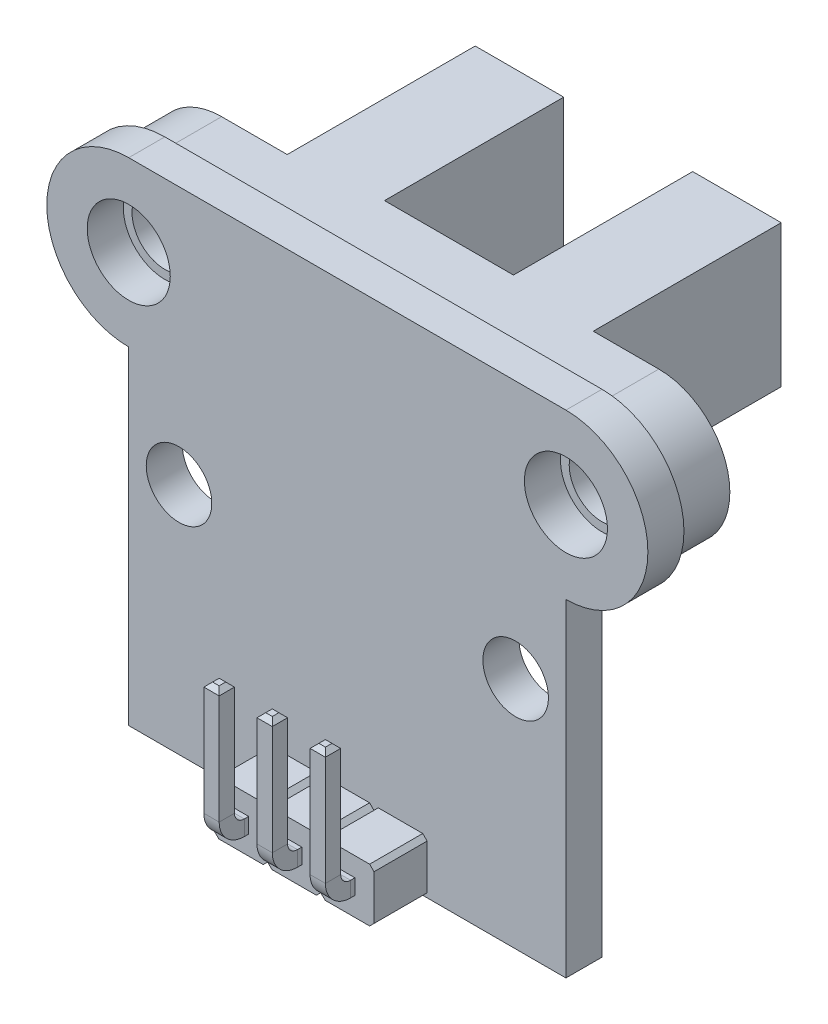
from build123d import *

# Parameters (mm, degrees)
SKETCH2_R           = 1.9
SKETCH2_R_2         = 1.5
BOSS_EXTRUDE1_DEPTH = 1.65
SKETCH3_W           = 0.7
SKETCH3_H           = 0.7
BOSS_EXTRUDE2_DEPTH = 2.43
SKETCH4_W           = 0.7
SKETCH4_H           = 0.7
CUT_EXTRUDE1_DEPTH  = 2.43
SKETCH5_W           = 0.7
SKETCH5_H           = 0.7
CHAMFER1_SIZE       = 0.2
LPATTERN1_COUNT     = 3
LPATTERN1_PITCH     = 2.43
SKETCH7_R           = 1.5
BOSS_EXTRUDE3_DEPTH = 2.6
SKETCH8_W           = 14
SKETCH8_H           = 6.5
BOSS_EXTRUDE4_DEPTH = 8.6
SKETCH9_W           = 5.9
SKETCH9_H           = 6.5
CUT_EXTRUDE2_DEPTH  = 8.2
BOSS_EXTRUDE5_DEPTH = 0.1
BOSS_EXTRUDE6_DEPTH = 0.1


with BuildPart() as part:
    # Sketch2 → Boss-Extrude1 (new body)
    with BuildSketch(Plane.XY):
        with BuildLine():
            Line((-10, -18.75), (-10, -3.75))
            ThreePointArc((-10, -3.75), (-13.75, 0), (-10, 3.75))
            Line((-10, 3.75), (10, 3.75))
            ThreePointArc((10, 3.75), (13.75, 0), (10, -3.75))
            Line((10, -3.75), (10, -18.75))
            Line((10, -18.75), (-10, -18.75))
        make_face()
        with Locations((10, 0)):
            Circle(SKETCH2_R, mode=Mode.SUBTRACT)
        with Locations((-10, 0)):
            Circle(SKETCH2_R, mode=Mode.SUBTRACT)
        with Locations((7.7, -8.05)):
            Circle(SKETCH2_R_2, mode=Mode.SUBTRACT)
        with Locations(Location((-7.7, -8.05, 0), (0, 0, 180))):
            Circle(SKETCH2_R_2, mode=Mode.SUBTRACT)
    extrude(amount=BOSS_EXTRUDE1_DEPTH)

    # Sketch4 → Cut-Extrude1 (cut)
    with BuildSketch(Plane.XY.offset(1.65)):
        with Locations((2.426666667, -17.525)):
            Rectangle(SKETCH4_W, SKETCH4_H)
        with Locations((-0.003333333, -17.525)):
            Rectangle(SKETCH4_W, SKETCH4_H)
        with Locations((-2.433333333, -17.525)):
            Rectangle(SKETCH4_W, SKETCH4_H)
    extrude(amount=-CUT_EXTRUDE1_DEPTH, mode=Mode.SUBTRACT)


with BuildPart() as body_2:
    # Sketch3 → Boss-Extrude2 (new body)
    with BuildSketch(Plane.XY.offset(1.65)):
        Polygon((3.45, -18.75), (1.416666667, -18.75), (1.216666667, -18.55), (1.016666667, -18.75), (-1.016666667, -18.75), (-1.216666667, -18.55), (-1.416666667, -18.75), (-3.45, -18.75), (-3.65, -18.55), (-3.65, -16.5), (-3.45, -16.3), (-1.416666667, -16.3), (-1.216666667, -16.5), (-1.016666667, -16.3), (1.016666667, -16.3), (1.216666667, -16.5), (1.416666667, -16.3), (3.45, -16.3), (3.65, -16.5), (3.65, -18.55), align=None)
        with Locations((-0.003333333, -17.525)):
            Rectangle(SKETCH3_W, SKETCH3_H, mode=Mode.SUBTRACT)
        with Locations((-2.433333333, -17.525)):
            Rectangle(SKETCH3_W, SKETCH3_H, mode=Mode.SUBTRACT)
        with Locations((2.426666667, -17.525)):
            Rectangle(SKETCH3_W, SKETCH3_H, mode=Mode.SUBTRACT)
    extrude(amount=BOSS_EXTRUDE2_DEPTH)


with BuildPart() as body_3:
    # Sweep1: sweep along a path in Sketch6
    with BuildLine(Plane.ZY.offset(2.433333333)) as sweep1_path:
        Line((-1, -17.525), (4.28, -17.525))
        ThreePointArc((4.28, -17.525), (4.845685425, -17.290685425), (5.08, -16.725))
        Line((5.08, -16.725), (5.08, -11.525))
    # Sketch5 → Sweep1 (sweep)
    with BuildSketch(Plane.XY.offset(-1)):
        with Locations((-2.433333333, -17.525)):
            Rectangle(SKETCH5_W, SKETCH5_H)
    sweep(path=sweep1_path.line)

    # Chamfer1
    chamfer1_edges = [body_3.edges().sort_by_distance(p)[0] for p in [
        (-2.433333333, -17.175, -1),
        (-2.783333333, -17.525, -1),
        (-2.433333333, -17.875, -1),
        (-2.083333333, -11.525, 5.08),
        (-2.433333333, -11.525, 4.73),
        (-2.783333333, -11.525, 5.08),
        (-2.433333333, -11.525, 5.43),
        (-2.083333333, -17.525, -1),
    ]]
    chamfer(chamfer1_edges, length=CHAMFER1_SIZE)


with BuildPart() as lpattern1_1:
    # LPattern1: pattern copy
    add(body_3.part.moved(Location(Vector(1, 0, 0) * (1 * LPATTERN1_PITCH))))


with BuildPart() as lpattern1_2:
    # LPattern1: pattern copy
    add(body_3.part.moved(Location(Vector(1, 0, 0) * (2 * LPATTERN1_PITCH))))


with BuildPart() as body_6:
    # Sketch7 → Boss-Extrude3 (new body)
    with BuildSketch(Plane(origin=(0, 0, 0), x_dir=(-1, 0, 0), z_dir=(0, 0, -1))):
        with BuildLine():
            Line((10, -3.25), (-10, -3.25))
            ThreePointArc((-10, -3.25), (-13.25, 0), (-10, 3.25))
            Line((-10, 3.25), (10, 3.25))
            ThreePointArc((10, 3.25), (13.25, 0), (10, -3.25))
        make_face()
        with Locations((-10, 0)):
            Circle(SKETCH7_R, mode=Mode.SUBTRACT)
        with Locations((10, 0)):
            Circle(SKETCH7_R, mode=Mode.SUBTRACT)
    extrude(amount=BOSS_EXTRUDE3_DEPTH)

    # Sketch8 → Boss-Extrude4 (add)
    with BuildSketch(Plane(origin=(0, 0, -2.6), x_dir=(-1, 0, 0), z_dir=(0, 0, -1))):
        Rectangle(SKETCH8_W, SKETCH8_H)
    extrude(amount=BOSS_EXTRUDE4_DEPTH)

    # Sketch9 → Cut-Extrude2 (cut)
    with BuildSketch(Plane(origin=(0, 0, -11.2), x_dir=(-1, 0, 0), z_dir=(0, 0, -1))):
        Rectangle(SKETCH9_W, SKETCH9_H)
    extrude(amount=-CUT_EXTRUDE2_DEPTH, mode=Mode.SUBTRACT)

    # Sketch10 → Boss-Extrude5 (add)
    with BuildSketch(Plane(origin=(0, 0, -11.2), x_dir=(-1, 0, 0), z_dir=(0, 0, -1))):
        Polygon((-5.103201591, -1.8452463), (-5.103201591, -0.943409624), (-6.385633173, -0.943409624), (-6.385633173, -0.776593002), (-5.103201591, -0.776593002), (-6.273012274, 1.136059696), (-5.205413608, 1.136059696), (-5.205413608, 2.203658363), (-4.744586392, 2.203658363), (-4.744586392, 1.136059696), (-3.676987726, 1.136059696), (-4.846798409, -0.776593002), (-3.564366827, -0.776593002), (-3.564366827, -0.943409624), (-4.846798409, -0.943409624), (-4.846798409, -1.8452463), align=None)
    extrude(amount=BOSS_EXTRUDE5_DEPTH)

    # Sketch11 → Boss-Extrude6 (add)
    # profile 1 of 7: a face of its own
    with BuildSketch(Plane(origin=(0, 0, -11.2), x_dir=(-1, 0, 0), z_dir=(0, 0, -1))):
        with BuildLine():
            add(Edge.make_bspline(
                [(4.127217434, 0.928389574), (4.1324997, 0.912752669), (4.143037474, 0.881558072), (4.153534993, 0.833060012), (4.160182952, 0.783575079), (4.160987111, 0.750125621), (4.161391283, 0.733313851)],
                knots=[0, 0, 0, 0, 0.994474773, 1.983911717, 2.986709619, 4, 4, 4, 4], degree=3))
            add(Edge.make_bspline(
                [(4.161391283, 0.733313851), (4.161081631, 0.720011242), (4.160478328, 0.694093456), (4.155861214, 0.656410681), (4.147994564, 0.621141768), (4.137252151, 0.588089621), (4.12287733, 0.557612219), (4.105718105, 0.52932936), (4.08530462, 0.503528993), (4.061616232, 0.480313029), (4.035024878, 0.459581001), (4.00530861, 0.441668313), (3.972649143, 0.426556034), (3.936924077, 0.41439115), (3.898402035, 0.404473331), (3.856793425, 0.39797921), (3.812264043, 0.39377157), (3.781573591, 0.393262301), (3.765722184, 0.392999268)],
                knots=[0, 0, 0, 0, 1.072461845, 2.089502642, 3.055154834, 3.982506854, 4.885653992, 5.766011576, 6.644638719, 7.530942326, 8.434292162, 9.357290509, 10.322575283, 11.330177533, 12.396475876, 13.525855063, 14.722121131, 16, 16, 16, 16], degree=3))
            add(Edge.make_bspline(
                [(3.765722184, 0.392999268), (3.750286888, 0.39332699), (3.720121967, 0.393967451), (3.67594444, 0.398382328), (3.63408115, 0.40609221), (3.594462689, 0.4164079), (3.557608044, 0.430033542), (3.523373904, 0.445988804), (3.492119297, 0.464719543), (3.463784648, 0.485963161), (3.438526681, 0.509833206), (3.41615598, 0.536021889), (3.397036739, 0.564755489), (3.380939477, 0.595621531), (3.368218483, 0.628750818), (3.359287179, 0.663879488), (3.353507416, 0.700907379), (3.352913856, 0.726231334), (3.352610182, 0.739187481)],
                knots=[0, 0, 0, 0, 1.219583202, 2.383409664, 3.503355981, 4.580195591, 5.613927346, 6.60373989, 7.560461434, 8.487729334, 9.396383554, 10.300965463, 11.203297331, 12.117485303, 13.046422561, 14.000383661, 14.976963838, 16, 16, 16, 16], degree=3))
            add(Edge.make_bspline(
                [(3.352610182, 0.739187481), (3.352703445, 0.748030774), (3.352886999, 0.765435546), (3.35460753, 0.791016649), (3.356925708, 0.815639936), (3.362047603, 0.846933444), (3.370616174, 0.884941784), (3.381412956, 0.913955914), (3.386784031, 0.928389574)],
                knots=[0, 0, 0, 0, 0.82263702, 1.61905864, 2.384719601, 3.122514214, 4.568537041, 6, 6, 6, 6], degree=3))
            Line((3.386784031, 0.928389574), (3.489305579, 0.928389574))
            add(Edge.make_bspline(
                [(3.489305579, 0.928389574), (3.485719131, 0.921370611), (3.478611992, 0.907461378), (3.46947177, 0.885870078), (3.461764169, 0.863901071), (3.454948606, 0.841523003), (3.450107047, 0.818390264), (3.446228405, 0.794415571), (3.444155805, 0.769363857), (3.443880351, 0.75230264), (3.443740447, 0.743637201)],
                knots=[0, 0, 0, 0, 0.983555818, 1.94907818, 2.92339169, 3.888715259, 4.866203398, 5.870584672, 6.918464223, 8, 8, 8, 8], degree=3))
            add(Edge.make_bspline(
                [(3.443740447, 0.743637201), (3.443930965, 0.734777746), (3.444303953, 0.717433063), (3.448679405, 0.69210356), (3.455096588, 0.66797449), (3.464492541, 0.645259384), (3.476164994, 0.62394211), (3.49067959, 0.604509431), (3.507025303, 0.586306574), (3.526080241, 0.570119296), (3.547385018, 0.555621271), (3.571039576, 0.543078354), (3.596697281, 0.531949849), (3.624683686, 0.522960435), (3.654705053, 0.515642185), (3.686848962, 0.510561929), (3.720988115, 0.507526274), (3.744416387, 0.507120704), (3.756466766, 0.506912099)],
                knots=[0, 0, 0, 0, 0.961321688, 1.882036724, 2.784158746, 3.668588788, 4.54556749, 5.416939704, 6.297416125, 7.197763834, 8.125489491, 9.091444601, 10.101847706, 11.159586289, 12.280336908, 13.455344771, 14.691151478, 16, 16, 16, 16], degree=3))
            add(Edge.make_bspline(
                [(3.756466766, 0.506912099), (3.769050133, 0.507058837), (3.79342092, 0.507343032), (3.828795793, 0.510211443), (3.861784113, 0.515004518), (3.892465294, 0.521468239), (3.920729269, 0.529959893), (3.946501827, 0.540523195), (3.970023702, 0.552774181), (3.991115419, 0.567037811), (4.009849936, 0.583197213), (4.026098157, 0.601169569), (4.039789731, 0.621067704), (4.051055576, 0.642616149), (4.059566787, 0.666057808), (4.065806478, 0.691099624), (4.06959518, 0.717951024), (4.070034984, 0.736445787), (4.070261018, 0.745951055)],
                knots=[0, 0, 0, 0, 1.344764027, 2.604466577, 3.790065809, 4.905748876, 5.95291627, 6.939762846, 7.878684932, 8.782738285, 9.654914262, 10.51702678, 11.364887745, 12.22998046, 13.108770886, 14.023899159, 14.984395335, 16, 16, 16, 16], degree=3))
            add(Edge.make_bspline(
                [(4.070261018, 0.745951055), (4.070144434, 0.754144838), (4.069913321, 0.770387975), (4.067450801, 0.79445337), (4.063824131, 0.818025676), (4.058354326, 0.841042128), (4.051756501, 0.863593684), (4.044184269, 0.885777215), (4.035013899, 0.907332811), (4.028140777, 0.921359319), (4.024695886, 0.928389574)],
                knots=[0, 0, 0, 0, 1.035533676, 2.052814528, 3.055360482, 4.048773743, 5.04096863, 6.025393086, 7.010303204, 8, 8, 8, 8], degree=3))
            Line((4.024695886, 0.928389574), (4.127217434, 0.928389574))
        make_face()
    # profile 2 of 7: a face of its own
    with BuildSketch(Plane(origin=(0, 0, -11.2), x_dir=(-1, 0, 0), z_dir=(0, 0, -1))):
        Polygon((3.364001465, 0.347434135), (3.867709765, 0.062652057), (4.15, 0.062652057), (4.15, -0.051260774), (3.865217922, -0.051260774), (3.364001465, -0.336042852), (3.364001465, -0.199347455), (3.650563431, -0.04592111), (3.765722184, 0.010679328), (3.661420748, 0.06371999), (3.364001465, 0.222130021), align=None)
    # profile 3 of 7: a face of its own
    with BuildSketch(Plane(origin=(0, 0, -11.2), x_dir=(-1, 0, 0), z_dir=(0, 0, -1))):
        Polygon((3.364001465, -0.358825418), (4.15, -0.415781834), (4.15, -0.563868514), (3.864327978, -0.653040903), (3.772841736, -0.677781346), (3.871803508, -0.705013632), (4.15, -0.791694177), (4.15, -0.928389574), (3.364001465, -0.98534599), (3.364001465, -0.882824442), (3.904197469, -0.849896514), (4.044630631, -0.84010713), (3.925200147, -0.80308546), (3.626000977, -0.710175307), (3.626000977, -0.638267832), (3.946380814, -0.532542486), (4.044630631, -0.497122715), (3.944422937, -0.494630872), (3.364001465, -0.461346966), align=None)
    # profile 4 of 7: a face of its own
    with BuildSketch(Plane(origin=(0, 0, -11.2), x_dir=(-1, 0, 0), z_dir=(0, 0, -1))):
        with BuildLine():
            add(Edge.make_bspline(
                [(6.390581927, 1.287214992), (6.399614794, 1.286988099), (6.41746274, 1.286539783), (6.443721658, 1.282595224), (6.469196352, 1.276699454), (6.493539094, 1.267799468), (6.516867632, 1.257077686), (6.538696024, 1.243995931), (6.558945358, 1.228806313), (6.577402581, 1.211425151), (6.594487957, 1.192405371), (6.609376252, 1.171211364), (6.622717862, 1.148386846), (6.633631865, 1.123561925), (6.642623728, 1.097214664), (6.648927687, 1.069354144), (6.653033972, 1.040110783), (6.653441148, 1.020127555), (6.653649372, 1.009908444)],
                knots=[0, 0, 0, 0, 1.012980012, 2.001536605, 2.973591609, 3.942221059, 4.904239254, 5.85072184, 6.792063077, 7.738826575, 8.691400281, 9.655673227, 10.639961518, 11.653204005, 12.693190617, 13.75902196, 14.853998857, 16, 16, 16, 16], degree=3))
            add(Edge.make_bspline(
                [(6.653649372, 1.009908444), (6.653436201, 0.999276213), (6.653021406, 0.978587618), (6.649056133, 0.94852864), (6.642443472, 0.920402031), (6.633435134, 0.894073054), (6.621653228, 0.869717675), (6.607107908, 0.847314589), (6.589532031, 0.827165719), (6.569177167, 0.809031719), (6.546070694, 0.792927743), (6.520054943, 0.779135385), (6.49137747, 0.767096136), (6.459807317, 0.757459769), (6.425356999, 0.749772459), (6.387988172, 0.744421678), (6.34757489, 0.740930868), (6.319631584, 0.740603232), (6.305147304, 0.740433403)],
                knots=[0, 0, 0, 0, 1.014028666, 1.973135184, 2.886201514, 3.766972031, 4.622683754, 5.461089008, 6.307784963, 7.165703144, 8.056080278, 8.988093605, 9.969998106, 11.019187833, 12.132953401, 13.334569633, 14.618386831, 16, 16, 16, 16], degree=3))
            add(Edge.make_bspline(
                [(6.305147304, 0.740433403), (6.285374673, 0.740784927), (6.246327737, 0.741479115), (6.19812565, 0.746709632), (6.160703288, 0.752748465), (6.133720847, 0.758909393), (6.107410163, 0.765951506), (6.082002553, 0.774449505), (6.057536746, 0.784493051), (6.033995633, 0.795759887), (6.011654622, 0.808935584), (5.990229546, 0.823378361), (5.970243731, 0.839918712), (5.951488166, 0.858021078), (5.934314768, 0.878137587), (5.91862218, 0.900087424), (5.904446525, 0.924034042), (5.892310228, 0.950189772), (5.881357286, 0.978133198), (5.872309604, 1.008255155), (5.864941852, 1.040579587), (5.859901052, 1.075335769), (5.856869029, 1.112494322), (5.856466878, 1.138054358), (5.856259553, 1.15123155)],
                knots=[0, 0, 0, 0, 1.86776132, 3.688449948, 4.57502302, 5.448166719, 6.3021877, 7.147777351, 7.977459899, 8.799818917, 9.611291397, 10.426048969, 11.238566389, 12.059184841, 12.88611679, 13.733933342, 14.605942585, 15.511193848, 16.455406888, 17.439626169, 18.479988232, 19.585148465, 20.755050142, 22, 22, 22, 22], degree=3))
            Line((5.856259553, 1.15123155), (5.856259553, 1.230258577))
            Line((5.856259553, 1.230258577), (5.947389818, 1.230258577))
            Line((5.947389818, 1.230258577), (5.947389818, 1.145179931))
            add(Edge.make_bspline(
                [(5.947389818, 1.145179931), (5.947574882, 1.133720204), (5.947933323, 1.11152453), (5.951243424, 1.079476643), (5.956211254, 1.049650561), (5.963783883, 1.022250038), (5.972958663, 0.997007734), (5.984087239, 0.974006258), (5.996905256, 0.953133991), (6.011356846, 0.934233672), (6.027712217, 0.917620275), (6.045530584, 0.902966529), (6.064987807, 0.890350254), (6.086049266, 0.879915739), (6.108476854, 0.871365692), (6.132250158, 0.86491338), (6.157110361, 0.859522318), (6.174300536, 0.857743267), (6.183046988, 0.856838077)],
                knots=[0, 0, 0, 0, 1.315973336, 2.548831764, 3.697292751, 4.785169583, 5.809382063, 6.778678215, 7.714946875, 8.61872859, 9.505493491, 10.386846915, 11.263974212, 12.163092911, 13.082011328, 14.016293524, 14.990679636, 16, 16, 16, 16], degree=3))
            Line((6.183046988, 0.856838077), (6.197998047, 0.854346234))
            add(Edge.make_bspline(
                [(6.197998047, 0.854346234), (6.19464009, 0.860887386), (6.187818721, 0.874175112), (6.179155025, 0.895403725), (6.171308305, 0.917964655), (6.16461005, 0.941977063), (6.158939668, 0.967187187), (6.155478622, 0.993584774), (6.15270184, 1.020885578), (6.152523584, 1.039446786), (6.152432914, 1.048887991)],
                knots=[0, 0, 0, 0, 0.874066819, 1.775583219, 2.723927479, 3.713478467, 4.739001445, 5.79372153, 6.877770845, 8, 8, 8, 8], degree=3))
            add(Edge.make_bspline(
                [(6.152432914, 1.048887991), (6.152606056, 1.058510758), (6.152941745, 1.077167425), (6.156440493, 1.104206484), (6.161881798, 1.12943211), (6.169515187, 1.152822146), (6.179209987, 1.174311806), (6.190553983, 1.194021458), (6.203877247, 1.211712859), (6.218652298, 1.227750044), (6.235363068, 1.241592038), (6.253456716, 1.253813721), (6.27312596, 1.26420296), (6.294375709, 1.272462193), (6.316887858, 1.279066852), (6.340522903, 1.283831795), (6.365233128, 1.286768119), (6.382030197, 1.287064234), (6.390581927, 1.287214992)],
                knots=[0, 0, 0, 0, 1.208556461, 2.343155189, 3.419431942, 4.447318821, 5.428339253, 6.377103145, 7.298556389, 8.20581645, 9.11071493, 10.018434325, 10.945509996, 11.899356745, 12.878363894, 13.890119218, 14.925816695, 16, 16, 16, 16], degree=3))
        make_face()
        with BuildLine():
            add(Edge.make_bspline(
                [(6.392183826, 1.173302161), (6.386187726, 1.173204825), (6.374469895, 1.173014607), (6.357343199, 1.171379904), (6.341095598, 1.168747518), (6.32580095, 1.165012293), (6.311391966, 1.160321195), (6.298246652, 1.153959404), (6.285953976, 1.146764038), (6.275128085, 1.137932204), (6.265361197, 1.128046951), (6.256860774, 1.1169308), (6.24921183, 1.104738768), (6.243126015, 1.091163489), (6.237919514, 1.076396436), (6.234793257, 1.060143377), (6.232516563, 1.042603942), (6.232289499, 1.030445001), (6.232171896, 1.024147548)],
                knots=[0, 0, 0, 0, 1.150142406, 2.247656637, 3.297444227, 4.305103413, 5.266169057, 6.197938694, 7.101757327, 7.992362899, 8.869704092, 9.762198851, 10.671947039, 11.624345717, 12.610627194, 13.66877388, 14.792593229, 16, 16, 16, 16], degree=3))
            add(Edge.make_bspline(
                [(6.232171896, 1.024147548), (6.232366481, 1.016599736), (6.232760625, 1.001311171), (6.236356621, 0.978458742), (6.241668068, 0.955675974), (6.248813978, 0.933344537), (6.257352579, 0.911746025), (6.26687288, 0.891123718), (6.277461195, 0.871998755), (6.285316108, 0.860114156), (6.289128312, 0.854346234)],
                knots=[0, 0, 0, 0, 0.996890633, 2.019264328, 3.050081844, 4.086608987, 5.114559797, 6.11781294, 7.086523066, 8, 8, 8, 8], degree=3))
            add(Edge.make_bspline(
                [(6.289128312, 0.854346234), (6.301648988, 0.854490542), (6.32563875, 0.854767039), (6.35997951, 0.856630989), (6.391103047, 0.860024358), (6.419194754, 0.864524938), (6.44436572, 0.870544325), (6.46681518, 0.877847043), (6.486687537, 0.886279913), (6.503973677, 0.896182234), (6.519009437, 0.907151585), (6.53132122, 0.919833351), (6.541711931, 0.933413881), (6.549559476, 0.948461346), (6.555420239, 0.964588123), (6.559470212, 0.981861395), (6.562009754, 1.000281244), (6.562346093, 1.012984988), (6.562519107, 1.019519839)],
                knots=[0, 0, 0, 0, 1.650217066, 3.161835375, 4.530521021, 5.774907608, 6.909062833, 7.93773963, 8.883385504, 9.748530785, 10.558635498, 11.327220022, 12.070075277, 12.804653334, 13.55422769, 14.326146309, 15.138963686, 16, 16, 16, 16], degree=3))
            add(Edge.make_bspline(
                [(6.562519107, 1.019519839), (6.562391471, 1.025045181), (6.562142058, 1.035842316), (6.559913241, 1.051692242), (6.55640317, 1.066848276), (6.551389514, 1.081257626), (6.545167998, 1.094902809), (6.537518709, 1.107611411), (6.528306574, 1.119202228), (6.518002417, 1.129960647), (6.506272834, 1.139554795), (6.49355394, 1.148411307), (6.479234308, 1.155572732), (6.464043969, 1.162110291), (6.447585098, 1.16694824), (6.430133496, 1.170849503), (6.411514603, 1.172887714), (6.39871422, 1.173162151), (6.392183826, 1.173302161)],
                knots=[0, 0, 0, 0, 1.025263836, 2.003479935, 2.965250052, 3.909196279, 4.830772784, 5.745014357, 6.654999909, 7.574137941, 8.504883283, 9.464127407, 10.444449464, 11.47130941, 12.530502809, 13.623626912, 14.787641707, 16, 16, 16, 16], degree=3))
        make_face(mode=Mode.SUBTRACT)
    # profile 5 of 7: a face of its own
    with BuildSketch(Plane(origin=(0, 0, -11.2), x_dir=(-1, 0, 0), z_dir=(0, 0, -1))):
        with BuildLine():
            add(Edge.make_bspline(
                [(6.249614799, 0.637911855), (6.264336956, 0.637749476), (6.293174149, 0.637431416), (6.335356407, 0.633694005), (6.375617626, 0.628110056), (6.413808193, 0.620139009), (6.449789426, 0.610012022), (6.483099995, 0.597075128), (6.51385104, 0.582005348), (6.541952896, 0.564490222), (6.567317987, 0.544811643), (6.58967847, 0.522648692), (6.608965954, 0.4982236), (6.625100294, 0.471440579), (6.638140519, 0.442414489), (6.647042439, 0.410807011), (6.652769601, 0.376891823), (6.653350367, 0.353450937), (6.653649372, 0.341382516)],
                knots=[0, 0, 0, 0, 1.248914837, 2.446326075, 3.590481536, 4.696348128, 5.754402402, 6.75852437, 7.724421974, 8.656180523, 9.563573712, 10.442878815, 11.321145607, 12.197505634, 13.09001432, 14.012532693, 14.976762566, 16, 16, 16, 16], degree=3))
            add(Edge.make_bspline(
                [(6.653649372, 0.341382516), (6.653396115, 0.330924683), (6.652897282, 0.310326146), (6.648355802, 0.280180485), (6.640870055, 0.251466917), (6.630391372, 0.224300842), (6.616741878, 0.198854452), (6.60012143, 0.175090297), (6.579960676, 0.153477546), (6.556617737, 0.133832891), (6.530134238, 0.116075088), (6.500052038, 0.100817303), (6.466733812, 0.08756243), (6.430047041, 0.076256422), (6.389878472, 0.067744168), (6.346261087, 0.061284997), (6.299098931, 0.057634116), (6.266470562, 0.057187261), (6.249614799, 0.056956416)],
                knots=[0, 0, 0, 0, 0.897207117, 1.767206898, 2.609613273, 3.439942234, 4.26013671, 5.082431154, 5.922077733, 6.789300863, 7.696067918, 8.652660293, 9.678696715, 10.770847102, 11.943518379, 13.199542273, 14.55328803, 16, 16, 16, 16], degree=3))
            add(Edge.make_bspline(
                [(6.249614799, 0.056956416), (6.234895576, 0.057222031), (6.206011349, 0.057743261), (6.163669825, 0.061049574), (6.123256033, 0.066973731), (6.084928288, 0.075034378), (6.048883805, 0.085454739), (6.015460847, 0.098347068), (5.984543945, 0.113182721), (5.956355397, 0.130487569), (5.931192882, 0.150303316), (5.908837481, 0.172391501), (5.889500706, 0.196851602), (5.873419598, 0.22379225), (5.860408671, 0.252942038), (5.851493465, 0.284538015), (5.845755133, 0.318272236), (5.84516923, 0.341535936), (5.84486827, 0.353485754)],
                knots=[0, 0, 0, 0, 1.248104217, 2.449214024, 3.598202953, 4.70919646, 5.767851728, 6.775909071, 7.743382507, 8.671783955, 9.574534295, 10.453175878, 11.330779933, 12.210788604, 13.107223223, 14.029045466, 14.98758374, 16, 16, 16, 16], degree=3))
            add(Edge.make_bspline(
                [(5.84486827, 0.353485754), (5.845124253, 0.363942804), (5.845628457, 0.384539798), (5.850122505, 0.414639734), (5.857720529, 0.443238442), (5.867963307, 0.470452801), (5.881486547, 0.49600996), (5.898472961, 0.519620529), (5.918725241, 0.541158182), (5.942088803, 0.560931128), (5.968803951, 0.578564157), (5.998865638, 0.594095533), (6.032365396, 0.607078451), (6.069020836, 0.618399125), (6.109204653, 0.627203904), (6.152856899, 0.633537134), (6.200069069, 0.637254326), (6.232698998, 0.637687363), (6.249614799, 0.637911855)],
                knots=[0, 0, 0, 0, 0.896346146, 1.765511063, 2.602189145, 3.429893923, 4.253790403, 5.07409759, 5.916402664, 6.782793596, 7.692923658, 8.655452938, 9.67862181, 10.769724156, 11.942363255, 13.202215208, 14.54959023, 16, 16, 16, 16], degree=3))
        make_face()
        with BuildLine():
            add(Edge.make_bspline(
                [(6.255666418, 0.523999023), (6.248840561, 0.523956865), (6.235177247, 0.523872478), (6.214903022, 0.522378874), (6.194894632, 0.52108482), (6.181739136, 0.519820358), (6.175215481, 0.519193326)],
                knots=[0, 0, 0, 0, 1.015675155, 2.033076313, 3.024625862, 4, 4, 4, 4], degree=3))
            Line((6.175215481, 0.519193326), (6.425823709, 0.193117847))
            add(Edge.make_bspline(
                [(6.425823709, 0.193117847), (6.435506687, 0.196310923), (6.454396711, 0.202540131), (6.480909517, 0.214839219), (6.504654165, 0.229584913), (6.524635276, 0.247701412), (6.541201109, 0.268241105), (6.551141685, 0.28786271), (6.557107995, 0.30462625), (6.560335768, 0.318224571), (6.562030203, 0.332677551), (6.562353887, 0.34256515), (6.562519107, 0.347612124)],
                knots=[0, 0, 0, 0, 1.369635289, 2.671950929, 3.919768706, 5.11129131, 6.280858786, 7.4472405, 8.047561792, 8.670450387, 9.321351747, 10, 10, 10, 10], degree=3))
            add(Edge.make_bspline(
                [(6.562519107, 0.347612124), (6.562294206, 0.354159164), (6.561850816, 0.367066551), (6.557892588, 0.385887562), (6.551980033, 0.40391415), (6.54298546, 0.420720343), (6.532044607, 0.436651258), (6.518400757, 0.451147579), (6.502652515, 0.464619561), (6.484354545, 0.476666288), (6.463769849, 0.487510951), (6.44086463, 0.497158221), (6.415533158, 0.505270395), (6.387901595, 0.511904917), (6.35810209, 0.517511431), (6.32599446, 0.521315616), (6.291596546, 0.523665383), (6.267892377, 0.523885496), (6.255666418, 0.523999023)],
                knots=[0, 0, 0, 0, 0.796325084, 1.569942251, 2.333029826, 3.098882654, 3.882521751, 4.680058524, 5.515410668, 6.401078198, 7.341567221, 8.345255342, 9.423649988, 10.576641411, 11.803778376, 13.113902518, 14.511430187, 16, 16, 16, 16], degree=3))
        make_face(mode=Mode.SUBTRACT)
        with BuildLine():
            add(Edge.make_bspline(
                [(6.248368877, 0.170869247), (6.254717178, 0.170861845), (6.267414056, 0.17084704), (6.286344495, 0.170957412), (6.304994374, 0.171585351), (6.317254008, 0.172655269), (6.323302161, 0.173183101)],
                knots=[0, 0, 0, 0, 1.015676347, 2.03139705, 3.028811753, 4, 4, 4, 4], degree=3))
            Line((6.323302161, 0.173183101), (6.072693933, 0.499436569))
            add(Edge.make_bspline(
                [(6.072693933, 0.499436569), (6.06293886, 0.496337566), (6.043917293, 0.490294771), (6.017569598, 0.477760086), (5.993999924, 0.46299498), (5.973922879, 0.445359825), (5.957509657, 0.424895721), (5.947383402, 0.405616418), (5.941442838, 0.389048756), (5.938175099, 0.375759668), (5.936496489, 0.361716178), (5.936166199, 0.352124927), (5.935998535, 0.347256146)],
                knots=[0, 0, 0, 0, 1.387365905, 2.705246439, 3.946796776, 5.150076001, 6.312935, 7.486775076, 8.085107282, 8.69814929, 9.339144989, 10, 10, 10, 10], degree=3))
            add(Edge.make_bspline(
                [(5.935998535, 0.347256146), (5.936231327, 0.340711984), (5.936690274, 0.327810272), (5.940527537, 0.308983874), (5.946862083, 0.291094591), (5.955623968, 0.274126554), (5.966849077, 0.258154991), (5.980903609, 0.243728768), (5.996881984, 0.230049846), (6.015646634, 0.218000808), (6.036677794, 0.207144773), (6.060147896, 0.197782838), (6.08585747, 0.189645438), (6.113829572, 0.182653821), (6.144240976, 0.177430785), (6.176911601, 0.173541102), (6.211906405, 0.17120809), (6.235965357, 0.170984512), (6.248368877, 0.170869247)],
                knots=[0, 0, 0, 0, 0.786408516, 1.550391895, 2.299573207, 3.062222815, 3.840203597, 4.637572255, 5.478018783, 6.364565426, 7.31230447, 8.320551553, 9.399100972, 10.553297605, 11.784944095, 13.107086051, 14.508566985, 16, 16, 16, 16], degree=3))
        make_face(mode=Mode.SUBTRACT)
    # profile 6 of 7: a face of its own
    with BuildSketch(Plane(origin=(0, 0, -11.2), x_dir=(-1, 0, 0), z_dir=(0, 0, -1))):
        with BuildLine():
            Line((6.642258088, -0.068347699), (6.642258088, -0.580955439))
            Line((6.642258088, -0.580955439), (6.545610171, -0.580955439))
            Line((6.545610171, -0.580955439), (6.345550761, -0.383031895))
            add(Edge.make_bspline(
                [(6.345550761, -0.383031895), (6.337665042, -0.37531425), (6.322552162, -0.36052348), (6.300784071, -0.339374402), (6.280210666, -0.320910123), (6.261282766, -0.304402991), (6.243582649, -0.289775965), (6.226621509, -0.277202474), (6.210662139, -0.266008271), (6.195232994, -0.256783823), (6.180580444, -0.248769362), (6.166257667, -0.242409689), (6.152426745, -0.2370621), (6.134061525, -0.232436067), (6.110472674, -0.228527663), (6.091283021, -0.228064056), (6.081415384, -0.227825662)],
                knots=[0, 0, 0, 0, 1.467781628, 2.812984966, 4.036667351, 5.144376027, 6.153886057, 7.089890156, 7.952406517, 8.745552503, 9.479984163, 10.172333011, 10.829086416, 11.449306875, 12.688391322, 14, 14, 14, 14], degree=3))
            add(Edge.make_bspline(
                [(6.081415384, -0.227825662), (6.071892602, -0.22820058), (6.053088531, -0.228940908), (6.030213739, -0.233885686), (6.012896348, -0.239428959), (6.000956684, -0.245098664), (5.989648116, -0.251488865), (5.979116141, -0.258903884), (5.969656915, -0.26759193), (5.960892438, -0.277172999), (5.953772899, -0.288404901), (5.947160524, -0.300460817), (5.942292748, -0.313993833), (5.938466796, -0.328623234), (5.936389201, -0.344586531), (5.936131657, -0.355616185), (5.935998535, -0.361317261)],
                knots=[0, 0, 0, 0, 1.786216299, 3.527135121, 4.372416622, 5.194637262, 6.0027823, 6.80939094, 7.605785013, 8.410469029, 9.238327819, 10.095268927, 10.986900131, 11.929653777, 12.929866349, 14, 14, 14, 14], degree=3))
            add(Edge.make_bspline(
                [(5.935998535, -0.361317261), (5.936283289, -0.369283836), (5.936846, -0.385026824), (5.940979006, -0.408085981), (5.948002638, -0.430012991), (5.957705126, -0.450748179), (5.969824788, -0.470346198), (5.983537209, -0.489132091), (5.99869783, -0.507340084), (6.01000464, -0.518512352), (6.015737517, -0.524177012)],
                knots=[0, 0, 0, 0, 1.023841796, 2.023244705, 3.000130015, 3.976032288, 4.95838074, 5.957638122, 6.964463877, 8, 8, 8, 8], degree=3))
            Line((6.015737517, -0.524177012), (5.947211829, -0.580955439))
            add(Edge.make_bspline(
                [(5.947211829, -0.580955439), (5.939702145, -0.573501579), (5.924729622, -0.558640357), (5.90504083, -0.533884194), (5.887527817, -0.507632862), (5.872186262, -0.479726811), (5.859726081, -0.449679062), (5.851087903, -0.417188317), (5.845861694, -0.382430431), (5.845205423, -0.358488273), (5.84486827, -0.346188214)],
                knots=[0, 0, 0, 0, 0.961904287, 1.917808245, 2.871393154, 3.830279184, 4.810558542, 5.822670133, 6.881417188, 8, 8, 8, 8], degree=3))
            add(Edge.make_bspline(
                [(5.84486827, -0.346188214), (5.844996428, -0.337752497), (5.845247311, -0.321238579), (5.848472014, -0.297084934), (5.853189231, -0.274016426), (5.859880349, -0.252090243), (5.868763483, -0.231575842), (5.878901428, -0.212270032), (5.891256472, -0.194659568), (5.905101995, -0.178464549), (5.920632232, -0.163700402), (5.938050209, -0.150990297), (5.956793685, -0.139540011), (5.977437253, -0.130424042), (5.9994183, -0.122824352), (6.022920786, -0.117841154), (6.047618152, -0.1144654), (6.06455371, -0.11409999), (6.073227899, -0.113912831)],
                knots=[0, 0, 0, 0, 1.101024146, 2.155385717, 3.176652834, 4.17421508, 5.142857198, 6.092783762, 7.017080387, 7.945816332, 8.872221856, 9.808299192, 10.757150569, 11.735138951, 12.749622124, 13.789302431, 14.867707268, 16, 16, 16, 16], degree=3))
            add(Edge.make_bspline(
                [(6.073227899, -0.113912831), (6.08058911, -0.114051536), (6.095105883, -0.114325071), (6.116425865, -0.116423842), (6.136877665, -0.120225991), (6.156625316, -0.1254216), (6.175976599, -0.132119411), (6.195246885, -0.140064789), (6.214303016, -0.149815847), (6.233472256, -0.160870028), (6.252650443, -0.17365387), (6.272357186, -0.187622145), (6.292003278, -0.20367027), (6.312405081, -0.220879964), (6.333160464, -0.239973436), (6.355190289, -0.260175877), (6.377897533, -0.282336199), (6.393325026, -0.297702181), (6.401261255, -0.305606767)],
                knots=[0, 0, 0, 0, 0.903006108, 1.780784919, 2.6244971, 3.452490889, 4.283422647, 5.135009645, 6.007370111, 6.907467505, 7.848200552, 8.833923043, 9.869470176, 10.958941075, 12.108048799, 13.328693938, 14.62582365, 16, 16, 16, 16], degree=3))
            Line((6.401261255, -0.305606767), (6.53973654, -0.444260042))
            Line((6.53973654, -0.444260042), (6.53973654, -0.068347699))
            Line((6.53973654, -0.068347699), (6.642258088, -0.068347699))
        make_face()
    # profile 7 of 7: a face of its own
    with BuildSketch(Plane(origin=(0, 0, -11.2), x_dir=(-1, 0, 0), z_dir=(0, 0, -1))):
        Polygon((6.642258088, -0.72904212), (6.642258088, -0.842954951), (6.277737029, -0.842954951), (6.277737029, -1.161910878), (6.642258088, -1.161910878), (6.642258088, -1.275823709), (5.856259553, -1.275823709), (5.856259553, -1.161910878), (6.186606764, -1.161910878), (6.186606764, -0.842954951), (5.856259553, -0.842954951), (5.856259553, -0.72904212), align=None)
    extrude(amount=BOSS_EXTRUDE6_DEPTH)


solid = Compound([part.part, body_2.part, body_3.part, lpattern1_1.part, lpattern1_2.part, body_6.part])
